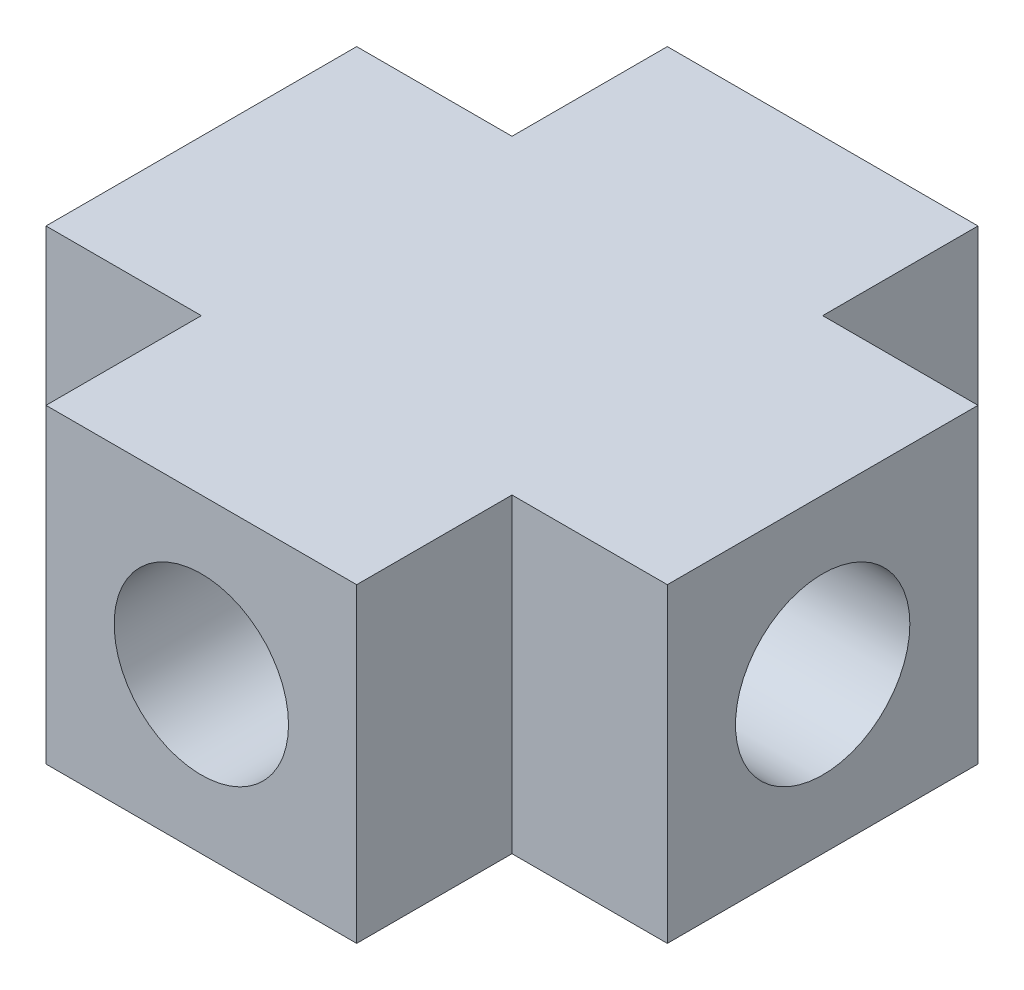
from build123d import *

# Parameters (mm, degrees)
BOSS_EXTRUDE1_DEPTH = 5
SKETCH2_R           = 2.8067
CUT_EXTRUDE1_DEPTH  = 5
CIRPATTERN1_COUNT   = 4


with BuildPart() as part:
    # Sketch1 → Boss-Extrude1 (new, symmetric)
    with BuildSketch(Plane(origin=(0, 0, 0), x_dir=(1, 0, 0), z_dir=(0, 1, 0))):
        Polygon((-10, 5), (-10, -5), (-5, -5), (-5, -10), (5, -10), (5, -5), (10, -5), (10, 5), (5, 5), (5, 10), (-5, 10), (-5, 5), align=None)
    extrude(amount=BOSS_EXTRUDE1_DEPTH, both=True)

    # Sketch2 → Cut-Extrude1 (cut)
    with BuildSketch(Plane.XY.offset(10)):
        Circle(SKETCH2_R)
    cut_extrude1 = extrude(amount=-CUT_EXTRUDE1_DEPTH, mode=Mode.SUBTRACT)

    # CirPattern1: Cut-Extrude1 ×4 about axis
    cirpattern1_axis = Axis((0, 0, 0), (0, 1, 0))
    for i in range(1, CIRPATTERN1_COUNT):
        add(cut_extrude1.rotate(cirpattern1_axis, i * 360 / CIRPATTERN1_COUNT), mode=Mode.SUBTRACT)


solid = part.part
